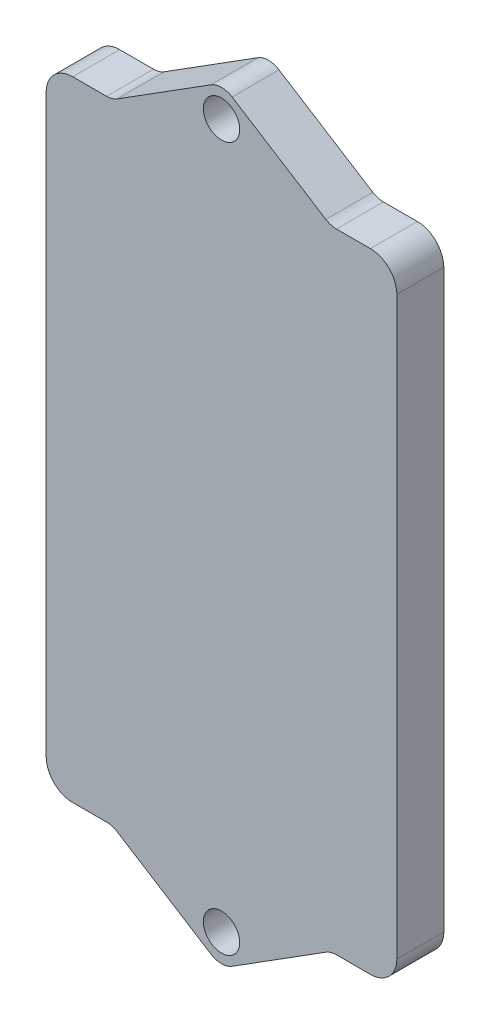
from build123d import *

# Parameters (mm, degrees)
ESQUISSE1_R                  = 2.75
BOSS_EXTRU_1_DEPTH           = 7.1
CONG_1_R                     = 3
CONG_2_R                     = 4
ENL_V_MAT_EXTRU_1_DEPTH      = 118.701866141
ENL_V_MAT_EXTRU_1_DEPTH_BACK = 78
CONG_3_R                     = 0.3


with BuildPart() as part:
    # Esquisse1 → Boss.-Extru.1 (new body)
    with BuildSketch(Plane.XY):
        Polygon((10, 95), (26.5, 105.4), (43, 95), (53, 95), (53, 0), (43, 0), (26.5, -10.4), (10, 0), (0, 0), (0, 95), align=None)
        with Locations((26.5, 100.71)):
            Circle(ESQUISSE1_R, mode=Mode.SUBTRACT)
        with Locations((26.5, -5.71)):
            Circle(ESQUISSE1_R, mode=Mode.SUBTRACT)
    extrude(amount=BOSS_EXTRU_1_DEPTH)

    # Congé1
    cong_1_edges = [part.edges().sort_by_distance(p)[0] for p in [
        (10, 95, 3.55),
        (26.5, 105.4, 3.55),
        (43, 95, 3.55),
        (43, 0, 3.55),
        (26.5, -10.4, 3.55),
        (10, 0, 3.55),
    ]]
    fillet(cong_1_edges, radius=CONG_1_R)

    # Congé2
    cong_2_edges = [part.edges().sort_by_distance(p)[0] for p in [
        (0, 95, 3.55),
        (53, 95, 3.55),
        (53, 0, 3.55),
        (0, 0, 3.55),
    ]]
    fillet(cong_2_edges, radius=CONG_2_R)

    # Esquisse3 → Enlèv. mat.-Extru.1 (cut, two sides: drawn at the far end of the back side and taken through both)
    with BuildSketch(Plane.XZ.offset(-ENL_V_MAT_EXTRU_1_DEPTH_BACK)):
        Polygon((5.154700538, 0), (4, 2), (4, 2.662509826), (10.145491142, 2.662509826), (10.145491142, 2.062509826), (8.954700538, 0), align=None)
        Polygon((44.009209397, 0), (42.854508858, 2), (42.854508858, 2.662509826), (49, 2.662509826), (49, 2.062509826), (47.809209397, 0), align=None)
    extrude(amount=ENL_V_MAT_EXTRU_1_DEPTH + ENL_V_MAT_EXTRU_1_DEPTH_BACK, mode=Mode.SUBTRACT)

    # Congé3
    cong_3_edges = [part.edges().sort_by_distance(p)[0] for p in [
        (44.009209397, 39, 0),
        (47.809209397, 39, 0),
        (8.954700538, 39, 0),
        (5.154700538, 39, 0),
    ]]
    fillet(cong_3_edges, radius=CONG_3_R)


solid = part.part
